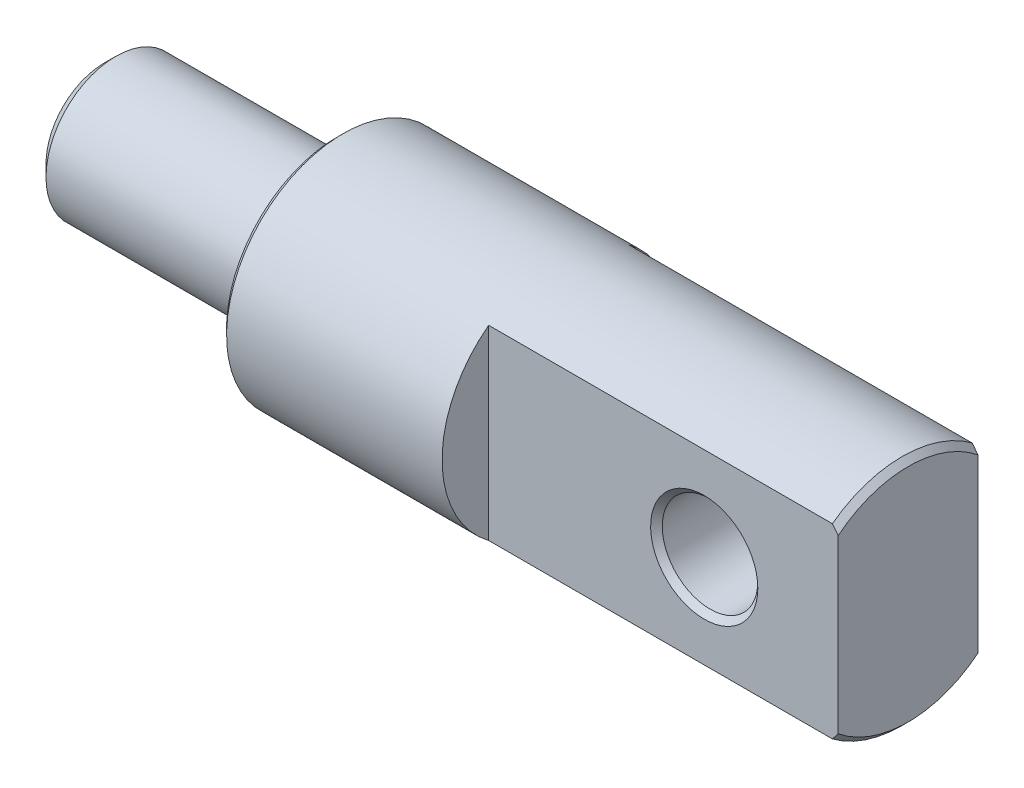
from build123d import *

# Parameters (mm, degrees)
CHANFREIN1_SIZE         = 0.5
CHANFREIN2_SIZE         = 1
ESQUISSE2_W             = 9
ESQUISSE2_H             = 30
ENL_V_MAT_EXTRU_1_DEPTH = 30
ENL_V_MAT_EXTRU_2_REACH = 73.533
ESQUISSE3_R             = 4.1
CHANFREIN3_SIZE         = 0.5


with BuildPart() as part:
    # Esquisse1 → Révolution1 (revolve)
    with BuildSketch(Plane.XY, mode=Mode.PRIVATE) as r_volution1_sk:
        Polygon((-49, 5), (-49, 10), (0, 10), (0, 0), (-69, 0), (-69, 6), (-50, 6), (-50, 5), align=None)
    revolve(r_volution1_sk.sketch.rotate(Axis((0, 0, 0), (1, 0, 0)), 90), axis=Axis((0, 0, 0), (1, 0, 0)))

    # Chanfrein1
    chanfrein1_edges = [part.edges().sort_by_distance(p)[0] for p in [
        (-49, 0, -10),
        (0, 0, -10),
    ]]
    chamfer(chanfrein1_edges, length=CHANFREIN1_SIZE)

    # Chanfrein2
    chanfrein2_edges = [part.edges().sort_by_distance(p)[0] for p in [
        (-69, 0, -6),
    ]]
    chamfer(chanfrein2_edges, length=CHANFREIN2_SIZE)

    # Esquisse2 → Enlèv. mat.-Extru.1 (cut)
    with BuildSketch(Plane(origin=(0, 0, 0), x_dir=(0, 0, -1), z_dir=(1, 0, 0))):
        with Locations((-10.5, 0)):
            Rectangle(ESQUISSE2_W, ESQUISSE2_H)
        with Locations((10.5, 0)):
            Rectangle(ESQUISSE2_W, ESQUISSE2_H)
    extrude(amount=-ENL_V_MAT_EXTRU_1_DEPTH, mode=Mode.SUBTRACT)

    # Esquisse3 → Enlèv. mat.-Extru.2 (cut, up to next)
    with BuildSketch(Plane.XY.offset(6), mode=Mode.PRIVATE) as enl_v_mat_extru_2_sk1:
        with Locations((-11.5, 0)):
            Circle(ESQUISSE3_R)
    enl_v_mat_extru_2_tool1 = extrude(enl_v_mat_extru_2_sk1.sketch, amount=-ENL_V_MAT_EXTRU_2_REACH, mode=Mode.PRIVATE) & part.part
    add(enl_v_mat_extru_2_tool1.solids().sort_by_distance((-11.5, 0, 6))[0], mode=Mode.SUBTRACT)

    # Chanfrein3
    chanfrein3_edges = [part.edges().sort_by_distance(p)[0] for p in [
        (-15.6, 0, 6),
        (-15.6, 0, -6),
    ]]
    chamfer(chanfrein3_edges, length=CHANFREIN3_SIZE)


solid = part.part
